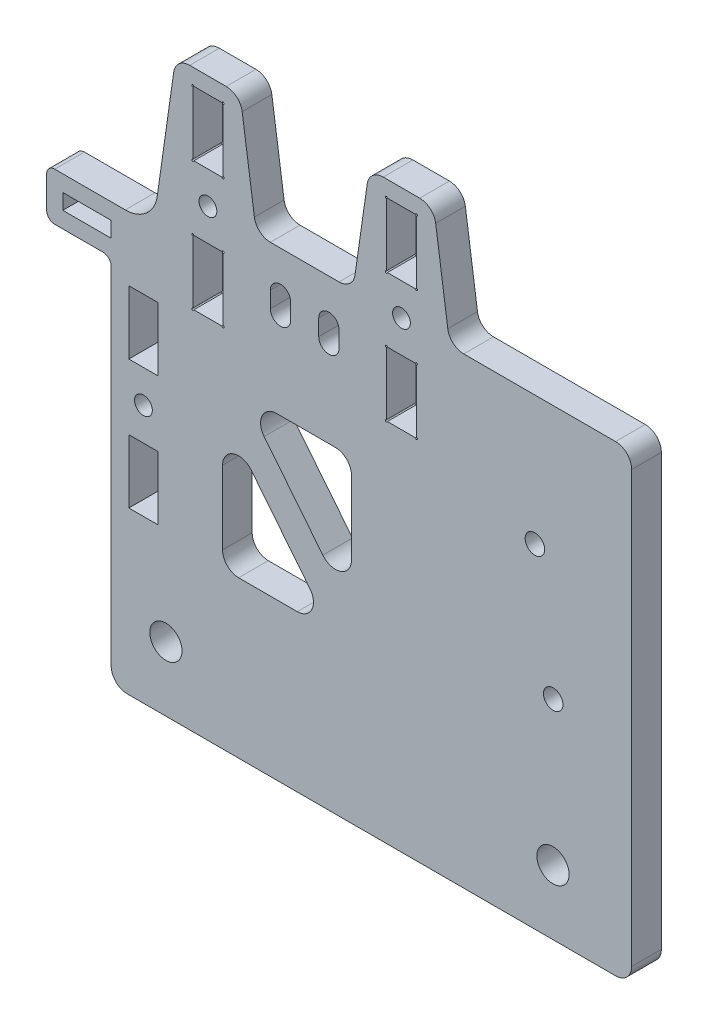
from build123d import *

# Parameters (mm, degrees)
SKETCH1_R           = 3.175
SKETCH1_R_2         = 1.7526
SKETCH1_W           = 5.742
SKETCH1_H           = 12.5
BOSS_EXTRUDE1_DEPTH = 5.842
CUT_EXTRUDE2_DEPTH  = 77.987395934
BOSS_EXTRUDE2_DEPTH = 5.842
FILLET1_R           = 3.175
SKETCH5_R           = 1.7526
CUT_EXTRUDE3_DEPTH  = 94.593735754
CUT_EXTRUDE4_DEPTH  = 94.593735754
FILLET2_R           = 3.175
CUT_EXTRUDE8_DEPTH  = 94.593735754
FILLET3_R           = 3.175
SKETCH11_R          = 1.9199987
CUT_EXTRUDE9_DEPTH  = 94.593735754
CUT_EXTRUDE10_DEPTH = 94.593735754
BOSS_EXTRUDE3_START = -5.842
SKETCH14_W          = 9.525
SKETCH14_H          = 3.048
BOSS_EXTRUDE3_DEPTH = 5.842
FILLET4_R           = 1.5875
FILLET5_R           = 6.35


with BuildPart() as part:
    # Sketch1 → Boss-Extrude1 (new body)
    with BuildSketch(Plane.XY):
        Polygon((51.85043079, -38.469674457), (-46.57456921, -38.469674457), (-46.57456921, 34.555325543), (-46.57456921, 52.615919343), (51.85043079, 52.615919343), (55.89718419, 52.615919343), (55.89718419, -38.469674457), align=None)
        with Locations((-35.79681581, -25.769674457)):
            Circle(SKETCH1_R, mode=Mode.SUBTRACT)
        with Locations((40.40318419, -25.769674457)):
            Circle(SKETCH1_R, mode=Mode.SUBTRACT)
        with Locations((-40.22456921, 12.330325543)):
            Circle(SKETCH1_R_2, mode=Mode.SUBTRACT)
        with Locations((-40.22456921, -0.369674457)):
            Rectangle(SKETCH1_W, SKETCH1_H, mode=Mode.SUBTRACT)
        with Locations((-40.22456921, 25.030325543)):
            Rectangle(SKETCH1_W, SKETCH1_H, mode=Mode.SUBTRACT)
    extrude(amount=BOSS_EXTRUDE1_DEPTH)

    # Sketch3 → Cut-Extrude2 (cut, through all)
    with BuildSketch(Plane.XY.offset(5.842)):
        with BuildLine():
            Line((-24.73850671, 33.565919343), (-30.31063171, 33.565919343))
            ThreePointArc((-30.31063171, 33.565919343), (-30.649385711, 33.425602841), (-30.50906921, 33.764356843))
            Line((-30.50906921, 33.764356843), (-30.50906921, 46.067481843))
            ThreePointArc((-30.50906921, 46.067481843), (-30.649385711, 46.406235845), (-30.31063171, 46.265919343))
            Line((-30.31063171, 46.265919343), (-24.73850671, 46.265919343))
            ThreePointArc((-24.73850671, 46.265919343), (-24.399752708, 46.406235845), (-24.54006921, 46.067481843))
            Line((-24.54006921, 46.067481843), (-24.54006921, 33.764356843))
            ThreePointArc((-24.54006921, 33.764356843), (-24.399752708, 33.425602841), (-24.73850671, 33.565919343))
        make_face()
        with BuildLine():
            Line((13.55993079, 33.764356843), (13.55993079, 46.067481843))
            ThreePointArc((13.55993079, 46.067481843), (13.700247292, 46.406235845), (13.36149329, 46.265919343))
            Line((13.36149329, 46.265919343), (7.78936829, 46.265919343))
            ThreePointArc((7.78936829, 46.265919343), (7.450614289, 46.406235845), (7.59093079, 46.067481843))
            Line((7.59093079, 46.067481843), (7.59093079, 33.764356843))
            ThreePointArc((7.59093079, 33.764356843), (7.450614289, 33.425602841), (7.78936829, 33.565919343))
            Line((7.78936829, 33.565919343), (13.36149329, 33.565919343))
            ThreePointArc((13.36149329, 33.565919343), (13.700247292, 33.425602841), (13.55993079, 33.764356843))
        make_face()
    extrude(amount=-CUT_EXTRUDE2_DEPTH, mode=Mode.SUBTRACT)

    # Sketch4 → Boss-Extrude2 (add)
    # profile 1 of 2: a face of its own
    with BuildSketch(Plane.XY.offset(5.842)):
        Polygon((1.036619808, 52.615919343), (4.22543079, 74.840919343), (16.92543079, 74.840919343), (20.086619808, 52.615919343), align=None)
        with BuildLine():
            Line((13.36149329, 71.665919343), (7.78936829, 71.665919343))
            ThreePointArc((7.78936829, 71.665919343), (7.450614289, 71.806235845), (7.59093079, 71.467481843))
            Line((7.59093079, 71.467481843), (7.59093079, 59.164356843))
            ThreePointArc((7.59093079, 59.164356843), (7.450614289, 58.825602841), (7.78936829, 58.965919343))
            Line((7.78936829, 58.965919343), (13.36149329, 58.965919343))
            ThreePointArc((13.36149329, 58.965919343), (13.700247292, 58.825602841), (13.55993079, 59.164356843))
            Line((13.55993079, 59.164356843), (13.55993079, 71.467481843))
            ThreePointArc((13.55993079, 71.467481843), (13.700247292, 71.806235845), (13.36149329, 71.665919343))
        make_face(mode=Mode.SUBTRACT)
    # profile 2 of 2: a face of its own
    with BuildSketch(Plane.XY.offset(5.842)):
        Polygon((-37.035758227, 52.615919343), (-17.985758227, 52.615919343), (-21.17456921, 74.840919343), (-33.87456921, 74.840919343), align=None)
        with BuildLine():
            Line((-24.54006921, 71.467481843), (-24.54006921, 59.164356843))
            ThreePointArc((-24.54006921, 59.164356843), (-24.399752708, 58.825602841), (-24.73850671, 58.965919343))
            Line((-24.73850671, 58.965919343), (-30.31063171, 58.965919343))
            ThreePointArc((-30.31063171, 58.965919343), (-30.649385711, 58.825602841), (-30.50906921, 59.164356843))
            Line((-30.50906921, 59.164356843), (-30.50906921, 71.467481843))
            ThreePointArc((-30.50906921, 71.467481843), (-30.649385711, 71.806235845), (-30.31063171, 71.665919343))
            Line((-30.31063171, 71.665919343), (-24.73850671, 71.665919343))
            ThreePointArc((-24.73850671, 71.665919343), (-24.399752708, 71.806235845), (-24.54006921, 71.467481843))
        make_face(mode=Mode.SUBTRACT)
    extrude(amount=-BOSS_EXTRUDE2_DEPTH)

    # Fillet1
    fillet1_edges = [part.edges().sort_by_distance(p)[0] for p in [
        (20.086619808, 52.615919343, 2.921),
        (16.92543079, 74.840919343, 2.921),
        (4.22543079, 74.840919343, 2.921),
        (1.036619808, 52.615919343, 2.921),
        (-17.985758227, 52.615919343, 2.921),
        (-21.17456921, 74.840919343, 2.921),
        (-33.87456921, 74.840919343, 2.921),
    ]]
    fillet(fillet1_edges, radius=FILLET1_R)

    # Sketch5 → Cut-Extrude3 (cut, through all)
    with BuildSketch(Plane.XY.offset(5.842)):
        with Locations((-27.52456921, 52.615919343)):
            Circle(SKETCH5_R)
        with Locations((10.57543079, 52.615919343)):
            Circle(SKETCH5_R)
    extrude(amount=-CUT_EXTRUDE3_DEPTH, mode=Mode.SUBTRACT)

    # Sketch6 → Cut-Extrude4 (cut, through all)
    with BuildSketch(Plane.XY.offset(5.842)):
        Polygon((-37.035758227, 52.615919343), (-39.167245046, 37.630325543), (-46.57456921, 37.630325543), (-46.57456921, 52.615919343), align=None)
    extrude(amount=-CUT_EXTRUDE4_DEPTH, mode=Mode.SUBTRACT)

    # Fillet2
    fillet2_edges = [part.edges().sort_by_distance(p)[0] for p in [
        (-39.167245046, 37.630325543, 2.921),
        (-46.57456921, 37.630325543, 2.921),
        (-46.57456921, -38.469674457, 2.921),
        (55.89718419, 52.615919343, 2.921),
        (55.89718419, -38.469674457, 2.921),
    ]]
    fillet(fillet2_edges, radius=FILLET2_R)

    # Sketch10 → Cut-Extrude8 (cut, through all)
    with BuildSketch(Plane.XY.offset(5.842)):
        Polygon((-20.587585319, 24.040919343), (0.74643079, 24.040919343), (0.74643079, -2.626600794), align=None)
        Polygon((-24.65356921, 18.958439479), (-24.65356921, -7.709080657), (-3.3195531, -7.709080657), align=None)
    extrude(amount=-CUT_EXTRUDE8_DEPTH, mode=Mode.SUBTRACT)

    # Fillet3
    fillet3_edges = [part.edges().sort_by_distance(p)[0] for p in [
        (0.74643079, 24.040919343, 2.921),
        (0.74643079, -2.626600794, 2.921),
        (-20.587585319, 24.040919343, 2.921),
        (-3.3195531, -7.709080657, 2.921),
        (-24.65356921, -7.709080657, 2.921),
        (-24.65356921, 18.958439479, 2.921),
    ]]
    fillet(fillet3_edges, radius=FILLET3_R)

    # Sketch11 → Cut-Extrude9 (cut, through all)
    with BuildSketch(Plane.XY.offset(5.842)):
        with Locations((36.84718419, 27.215919343)):
            Circle(SKETCH11_R)
        with Locations((40.44717699, 2.565930543)):
            Circle(SKETCH11_R)
    extrude(amount=-CUT_EXTRUDE9_DEPTH, mode=Mode.SUBTRACT)

    # Sketch12 → Cut-Extrude10 (cut, through all)
    with BuildSketch(Plane.XY.offset(5.842)):
        with BuildLine():
            Line((-5.71206921, 41.291183898), (-5.71206921, 44.466183898))
            ThreePointArc((-5.71206921, 44.466183898), (-3.71206921, 46.466183898), (-1.71206921, 44.466183898))
            Line((-1.71206921, 44.466183898), (-1.71206921, 41.291183898))
            ThreePointArc((-1.71206921, 41.291183898), (-3.71206921, 39.291183898), (-5.71206921, 41.291183898))
        make_face()
        with BuildLine():
            Line((-11.23706921, 41.291183898), (-11.23706921, 44.466183898))
            ThreePointArc((-11.23706921, 44.466183898), (-13.23706921, 46.466183898), (-15.23706921, 44.466183898))
            Line((-15.23706921, 44.466183898), (-15.23706921, 41.291183898))
            ThreePointArc((-15.23706921, 41.291183898), (-13.23706921, 39.291183898), (-11.23706921, 41.291183898))
        make_face()
    extrude(amount=-CUT_EXTRUDE10_DEPTH, mode=Mode.SUBTRACT)

    # Sketch14 → Boss-Extrude3 (add)
    with BuildSketch(Plane.XY.offset(5.842).offset(BOSS_EXTRUDE3_START)):
        with BuildLine():
            Line((-42.661085862, 37.630325543), (-42.661085862, 34.455325543))
            Line((-42.661085862, 34.455325543), (-59.27456921, 34.455325543))
            Line((-59.27456921, 34.455325543), (-59.27456921, 37.630325543))
            Line((-59.27456921, 37.630325543), (-59.27456921, 43.853325543))
            Line((-59.27456921, 43.853325543), (-38.282112121, 43.853325543))
            Line((-38.282112121, 43.853325543), (-38.779239988, 40.358227091))
            ThreePointArc((-38.779239988, 40.358227091), (-39.84160667, 38.40739283), (-41.922602515, 37.630325543))
            Line((-41.922602515, 37.630325543), (-42.661085862, 37.630325543))
        make_face()
        with Locations((-51.33706921, 39.154325543)):
            Rectangle(SKETCH14_W, SKETCH14_H, mode=Mode.SUBTRACT)
    extrude(amount=BOSS_EXTRUDE3_DEPTH)

    # Fillet4
    fillet4_edges = [part.edges().sort_by_distance(p)[0] for p in [
        (-46.57456921, 34.455325543, 2.921),
        (-59.27456921, 43.853325543, 2.921),
        (-59.27456921, 34.455325543, 2.921),
    ]]
    fillet(fillet4_edges, radius=FILLET4_R)

    # Fillet5
    fillet5_edges = [part.edges().sort_by_distance(p)[0] for p in [
        (-38.282112121, 43.853325543, 2.921),
    ]]
    fillet(fillet5_edges, radius=FILLET5_R)


solid = part.part
